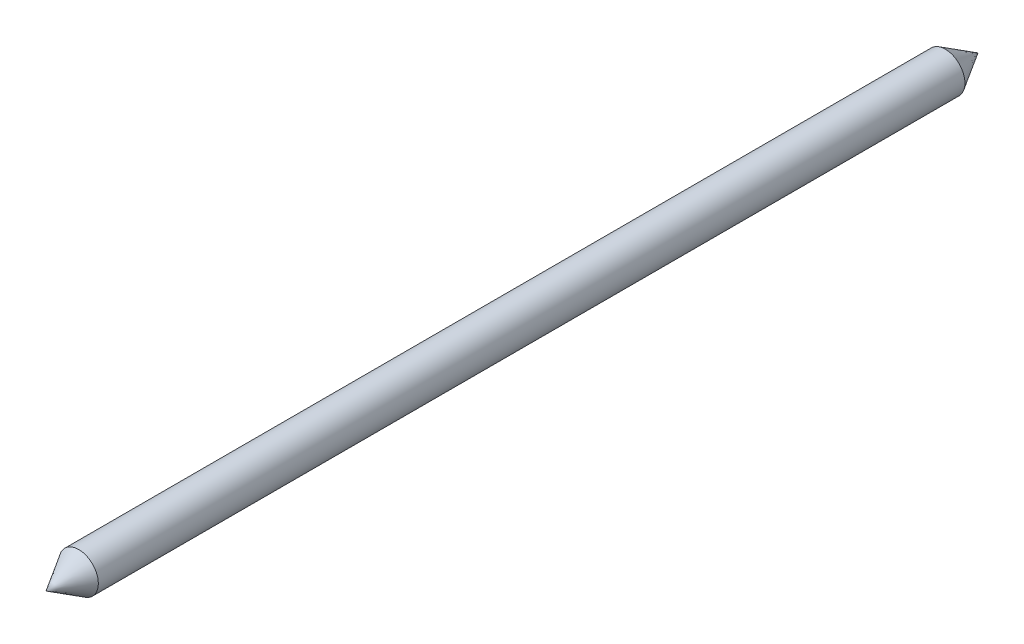
from build123d import *


with BuildPart() as part:
    # Sketch2 → Revolve1 (revolve)
    with BuildSketch(Plane(origin=(0, 0, 0), x_dir=(1, 0, 0), z_dir=(0, 1, 0))):
        Polygon((7.62, 168.275), (7.62, -168.275), (0, -180.975), (0, 180.975), align=None)
    revolve(axis=Axis((0, 0, 180.975), (0, 0, -1)))


solid = part.part
